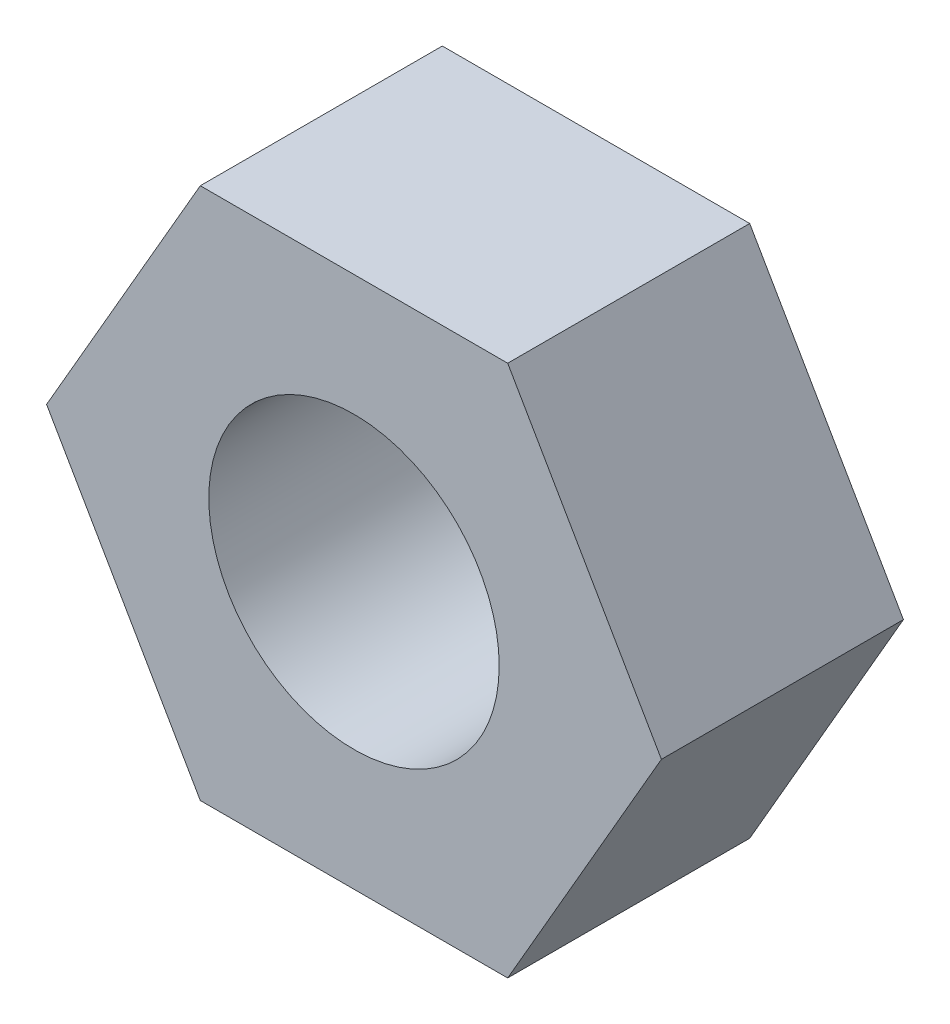
from build123d import *

# Parameters (mm, degrees)
SKETCH_1_R      = 1.5
EXTRUDE_1_DEPTH = 2.5


with BuildPart() as part:
    # Эскиз1 → Бобышка-Вытянуть1 (new body)
    with BuildSketch(Plane.XY):
        Polygon((1.58771324, -2.75), (3.175426481, 0), (1.58771324, 2.75), (-1.58771324, 2.75), (-3.175426481, 0), (-1.58771324, -2.75), align=None)
        Circle(SKETCH_1_R, mode=Mode.SUBTRACT)
    extrude(amount=EXTRUDE_1_DEPTH)


solid = part.part
